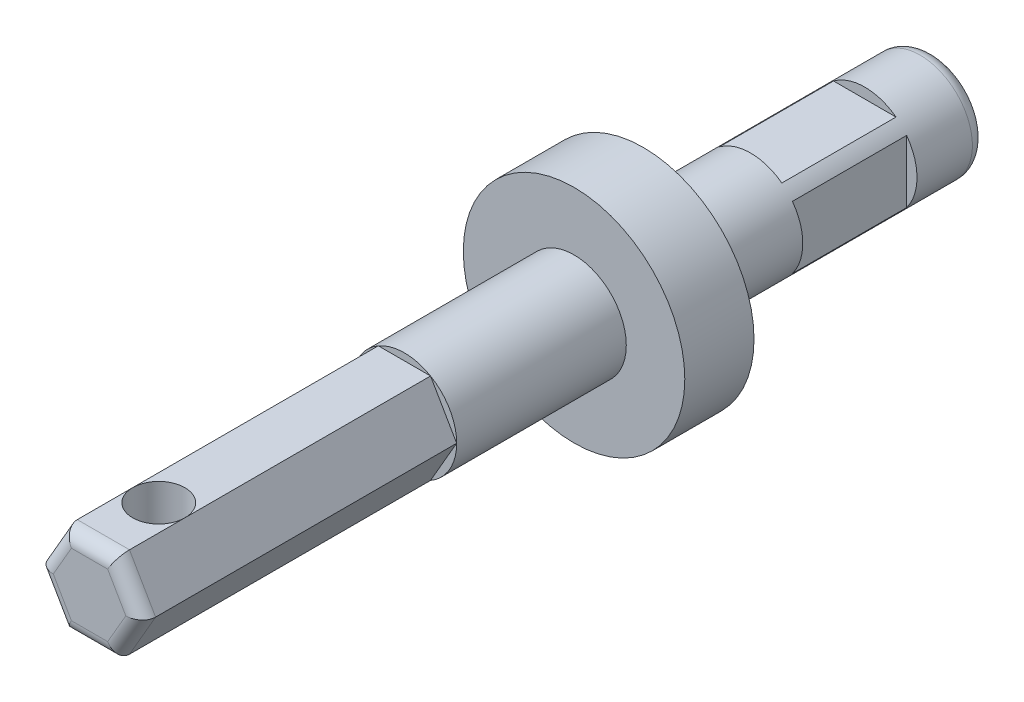
from build123d import *
from build123d.topology import SkipClean

# Parameters (mm, degrees)
BOSS_EXTRUDE1_DEPTH  = 8.25
SKETCH2_R            = 3.773
BOSS_EXTRUDE2_DEPTH  = 7.75
BOSS_EXTRUDE3_DEPTH  = 30
BOSS_EXTRUDE4_START  = 8.25
BOSS_EXTRUDE4_DEPTH  = 8.25
BOSS_EXTRUDE6_DEPTH  = 10
SKETCH7_R            = 3.773
BOSS_EXTRUDE7_DEPTH  = 7.254
BOSS_EXTRUDE8_DEPTH  = 10
BOSS_EXTRUDE9_START  = 5
SKETCH9_R            = 3.773
BOSS_EXTRUDE9_DEPTH  = 5
FILLET1_R            = 1
SKETCH10_R           = 8
BOSS_EXTRUDE10_DEPTH = 5
SKETCH11_R           = 1.8865
CUT_EXTRUDE1_DEPTH   = 58.679778678
FILLET2_R            = 1


with BuildPart() as part:
    # Sketch1 → Boss-Extrude1 (new body)
    with BuildSketch(Plane.XY):
        with BuildLine():
            Line((-2.257653649, 3.023), (2.257653649, 3.023))
            ThreePointArc((2.257653649, 3.023), (2.667913885, 2.667913885), (3.023, 2.257653649))
            Line((3.023, 2.257653649), (3.023, -2.257653649))
            ThreePointArc((3.023, -2.257653649), (-2.667913885, -2.667913885), (-2.257653649, 3.023))
        make_face()
        with BuildLine():
            Line((-2.56499937, 0.001798246), (-0.001798246, 2.56499937))
            ThreePointArc((-0.001798246, 2.56499937), (1.813728894, 1.813728894), (2.56499937, -0.001798246))
            Line((2.56499937, -0.001798246), (0.001798246, -2.56499937))
            ThreePointArc((0.001798246, -2.56499937), (-1.813728894, -1.813728894), (-2.56499937, 0.001798246))
        make_face(mode=Mode.SUBTRACT)
    extrude(amount=BOSS_EXTRUDE1_DEPTH)

    # Sketch2 → Boss-Extrude2 (add)
    with SkipClean():  # the faces are left unmerged after this step: merging them gives an invalid solid
        with BuildSketch(Plane.XY.offset(8.25)):
            with Locations(Location((0, 0, 0), (0, 0, 126.753315451))):
                Circle(SKETCH2_R)
        extrude(amount=BOSS_EXTRUDE2_DEPTH)

    # Sketch3 → Boss-Extrude3 (add)
    with SkipClean():  # the faces are left unmerged after this step: merging them gives an invalid solid
        with BuildSketch(Plane.XY.offset(16)):
            Polygon((1.8865, 3.267513848), (-1.8865, 3.267513848), (-3.773, 0), (-1.8865, -3.267513848), (1.8865, -3.267513848), (3.773, 0), align=None)
        extrude(amount=BOSS_EXTRUDE3_DEPTH)

    # Sketch4 → Boss-Extrude4 (add)
    with SkipClean():  # the faces are left unmerged after this step: merging them gives an invalid solid
        with BuildSketch(Plane(origin=(0, 0, 8.25), x_dir=(-1, 0, 0), z_dir=(0, 0, -1)).offset(BOSS_EXTRUDE4_START)):
            with BuildLine():
                Line((-2.56499937, -0.001798246), (-0.001798246, -2.56499937))
                ThreePointArc((-0.001798246, -2.56499937), (1.813728894, -1.813728894), (2.56499937, 0.001798246))
                Line((2.56499937, 0.001798246), (0.001798246, 2.56499937))
                ThreePointArc((0.001798246, 2.56499937), (-1.813728894, 1.813728894), (-2.56499937, -0.001798246))
            make_face()
        extrude(amount=-BOSS_EXTRUDE4_DEPTH)

    # Sketch6 → Boss-Extrude6 (add)
    with SkipClean():  # the faces are left unmerged after this step: merging them gives an invalid solid
        with BuildSketch(Plane.XY.offset(16)):
            with BuildLine():
                ThreePointArc((1.8865, 3.267513848), (0, 3.773), (-1.8865, 3.267513848))
                ThreePointArc((-1.8865, 3.267513848), (-3.267513848, 1.8865), (-3.773, 0))
                ThreePointArc((-3.773, 0), (-3.267513848, -1.8865), (-1.8865, -3.267513848))
                ThreePointArc((-1.8865, -3.267513848), (0, -3.773), (1.8865, -3.267513848))
                ThreePointArc((1.8865, -3.267513848), (3.267513848, -1.8865), (3.773, 0))
                ThreePointArc((3.773, 0), (3.267513848, 1.8865), (1.8865, 3.267513848))
            make_face()
        extrude(amount=BOSS_EXTRUDE6_DEPTH)

    # Sketch7 → Boss-Extrude7 (add)
    with SkipClean():  # the faces are left unmerged after this step: merging them gives an invalid solid
        with BuildSketch(Plane.XY.offset(26)):
            with Locations(Location((0, 0, 0), (0, 0, 180))):
                Circle(SKETCH7_R)
        extrude(amount=BOSS_EXTRUDE7_DEPTH)

    # Sketch8 → Boss-Extrude8 (add)
    with SkipClean():  # the faces are left unmerged after this step: merging them gives an invalid solid
        with BuildSketch(Plane.XY.offset(46)):
            Polygon((3.773, 0), (1.8865, 3.267513848), (-1.8865, 3.267513848), (-3.773, 0), (-1.8865, -3.267513848), (1.8865, -3.267513848), align=None)
        extrude(amount=BOSS_EXTRUDE8_DEPTH)

    # Sketch9 → Boss-Extrude9 (add)
    with SkipClean():  # the faces are left unmerged after this step: merging them gives an invalid solid
        with BuildSketch(Plane(origin=(0, 0, 0), x_dir=(-1, 0, 0), z_dir=(0, 0, -1)).offset(BOSS_EXTRUDE9_START)):
            Circle(SKETCH9_R)
        extrude(amount=-BOSS_EXTRUDE9_DEPTH)

    # Fillet1
    fillet1_edges = [part.edges().sort_by_distance(p)[0] for p in [
        (3.773, 0, -5),
    ]]
    fillet(fillet1_edges, radius=FILLET1_R)

    # Sketch10 → Boss-Extrude10 (add)
    with BuildSketch(Plane.XY.offset(16)):
        Circle(SKETCH10_R)
    extrude(amount=BOSS_EXTRUDE10_DEPTH)

    # Sketch11 → Cut-Extrude1 (cut, through all)
    with SkipClean():  # the faces are left unmerged after this step: merging them gives an invalid solid
        with BuildSketch(Plane(origin=(0, 3.267513848, 0), x_dir=(1, 0, 0), z_dir=(0, 1, 0))):
            with Locations(Location((0, -51, 0), (0, 0, 180))):
                Circle(SKETCH11_R)
        extrude(amount=-CUT_EXTRUDE1_DEPTH, mode=Mode.SUBTRACT)

    # Fillet2
    fillet2_edges = [part.edges().sort_by_distance(p)[0] for p in [
        (2.82975, -1.633756924, 56),
        (2.82975, 1.633756924, 56),
        (0, 3.267513848, 56),
        (-2.82975, 1.633756924, 56),
        (-2.82975, -1.633756924, 56),
        (0, -3.267513848, 56),
    ]]
    fillet(fillet2_edges, radius=FILLET2_R)


solid = part.part
